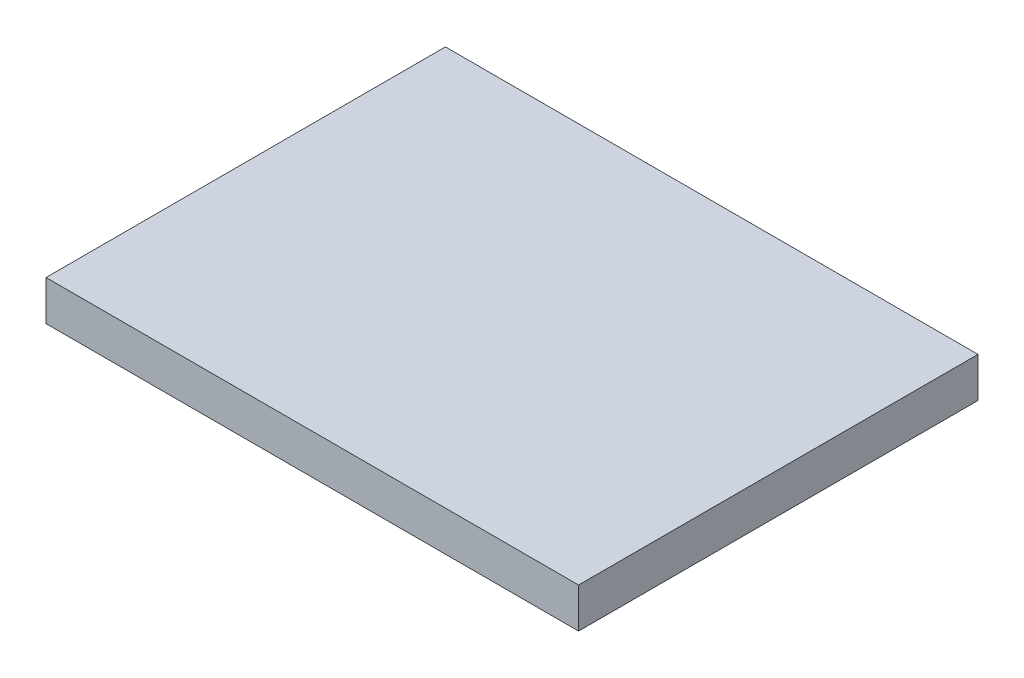
from build123d import *

# Parameters (mm, degrees)
SKETCH1_W           = 40
SKETCH1_H           = 30
BOSS_EXTRUDE1_DEPTH = 1.5


with BuildPart() as part:
    # Sketch1 → Boss-Extrude1 (new, symmetric)
    with BuildSketch(Plane(origin=(0, 0, 0), x_dir=(1, 0, 0), z_dir=(0, 1, 0))):
        Rectangle(SKETCH1_W, SKETCH1_H)
    extrude(amount=BOSS_EXTRUDE1_DEPTH, both=True)


solid = part.part
